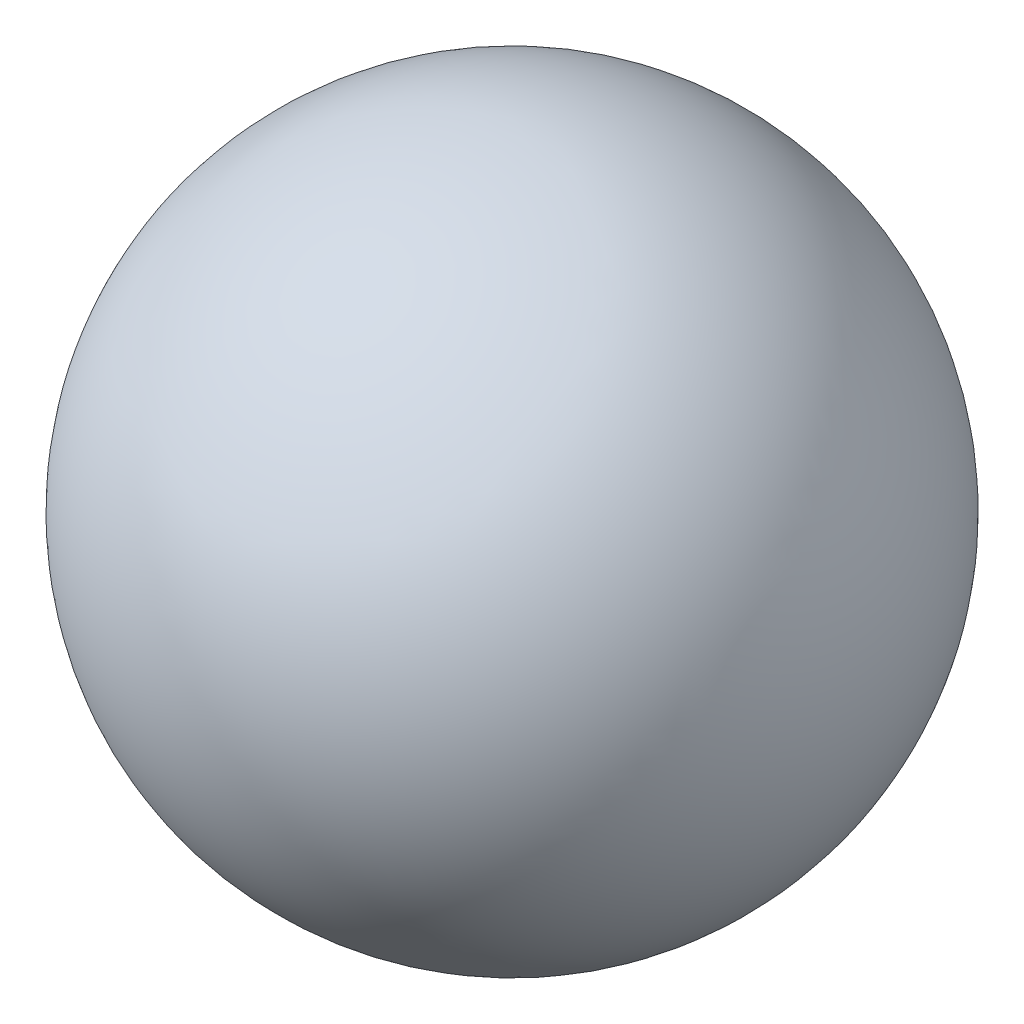
from build123d import *


with BuildPart() as part:
    # 草图1 → 旋转6 (revolve)
    with BuildSketch(Plane.XY):
        with BuildLine():
            Line((9, 0), (-9, 0))
            ThreePointArc((-9, 0), (0, 9), (9, 0))
        make_face()
    revolve(axis=Axis((9, 0, 0), (-1, 0, 0)))


solid = part.part
